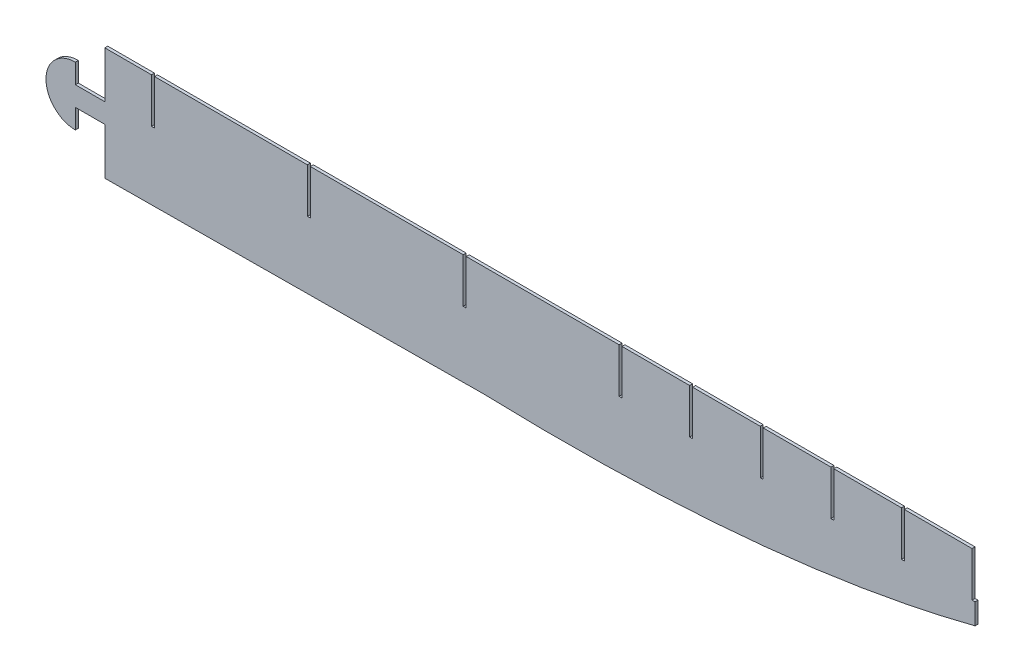
from build123d import *

# Parameters (mm, degrees)
BOSS_EXTRUDE1_DEPTH = 3


with BuildPart() as part:
    # Model → Boss-Extrude1 (new body)
    with BuildSketch(Plane.XY):
        with BuildLine():
            Line((1130.2, -228.052661621), (1130.2, -248.052661621))
            Line((1130.2, -248.052661621), (1160.2, -248.052661621))
            Line((1160.2, -248.052661621), (1160.2, -200.422661621))
            Line((1160.2, -200.422661621), (1207.901037796, -200.422661621))
            Line((1207.901037796, -200.422661621), (1207.901037796, -245.979700014))
            Line((1207.901037796, -245.979700014), (1210.901037796, -245.979700014))
            Line((1210.901037796, -245.979700014), (1210.901037796, -200.422661621))
            Line((1210.901037796, -200.422661621), (1366.901037796, -200.422661621))
            Line((1366.901037796, -200.422661621), (1366.901037796, -245.979700014))
            Line((1366.901037796, -245.979700014), (1369.901037796, -245.979700014))
            Line((1369.901037796, -245.979700014), (1369.901037796, -200.422661621))
            Line((1369.901037796, -200.422661621), (1525.901037796, -200.422661621))
            Line((1525.901037796, -200.422661621), (1525.901037796, -245.979700014))
            Line((1525.901037796, -245.979700014), (1528.901037796, -245.979700014))
            Line((1528.901037796, -245.979700014), (1528.901037796, -200.422661621))
            Line((1528.901037796, -200.422661621), (1684.901037801, -200.422661621))
            Line((1684.901037801, -200.422661621), (1684.901037801, -245.979700014))
            Line((1684.901037801, -245.979700014), (1687.901037795, -245.979700014))
            Line((1687.901037795, -245.979700014), (1687.901037795, -200.422661621))
            Line((1687.901037795, -200.422661621), (1756.943542984, -200.422661621))
            Line((1756.943542984, -200.422661621), (1756.943542984, -245.979700014))
            Line((1756.943542984, -245.979700014), (1759.943542984, -245.979700014))
            Line((1759.943542984, -245.979700014), (1759.943542984, -200.422661621))
            Line((1759.943542984, -200.422661621), (1828.986048173, -200.422661621))
            Line((1828.986048173, -200.422661621), (1828.986048173, -245.979700014))
            Line((1828.986048173, -245.979700014), (1831.986048173, -245.979700014))
            Line((1831.986048173, -245.979700014), (1831.986048173, -200.422661621))
            Line((1831.986048173, -200.422661621), (1901.028553362, -200.422661621))
            Line((1901.028553362, -200.422661621), (1901.028553362, -245.979700014))
            Line((1901.028553362, -245.979700014), (1904.028553362, -245.979700014))
            Line((1904.028553362, -245.979700014), (1904.028553362, -200.422661621))
            Line((1904.028553362, -200.422661621), (1973.071058551, -200.422661621))
            Line((1973.071058551, -200.422661621), (1973.071058551, -245.979700014))
            Line((1973.071058551, -245.979700014), (1976.071058551, -245.979700014))
            Line((1976.071058551, -245.979700014), (1976.071058551, -200.422661621))
            Line((1976.071058551, -200.422661621), (2045.113563739, -200.422661621))
            Line((2045.113563739, -200.422661621), (2045.113563739, -245.979700014))
            Line((2045.113563739, -245.979700014), (2048.11356374, -245.979700014))
            Line((2048.11356374, -245.979700014), (2048.11356374, -267.236738408))
            add(Edge.make_bspline(
                [(2048.11356374, -267.236738408), (1921.116123258, -299.875981212), (1758.376470444, -319.638055471), (1545.730966639, -313)],
                knots=[0.571508356, 0.571508356, 0.571508356, 0.571508356, 1, 1, 1, 1], degree=3))
            add(Edge.make_bspline(
                [(1545.730966639, -313), (1417.219843878, -313.786784413), (1288.709572371, -314.686711241), (1160.2, -315.679561973)],
                knots=[0, 0, 0, 0, 1, 1, 1, 1], degree=3))
            Line((1160.2, -315.679561973), (1160.2, -268.052661621))
            Line((1160.2, -268.052661621), (1130.2, -268.052661621))
            Line((1130.2, -268.052661621), (1130.2, -288.052661621))
            ThreePointArc((1130.2, -288.052661621), (1100.2, -258.052661621), (1130.2, -228.052661621))
        make_face()
    extrude(amount=BOSS_EXTRUDE1_DEPTH)


solid = part.part
